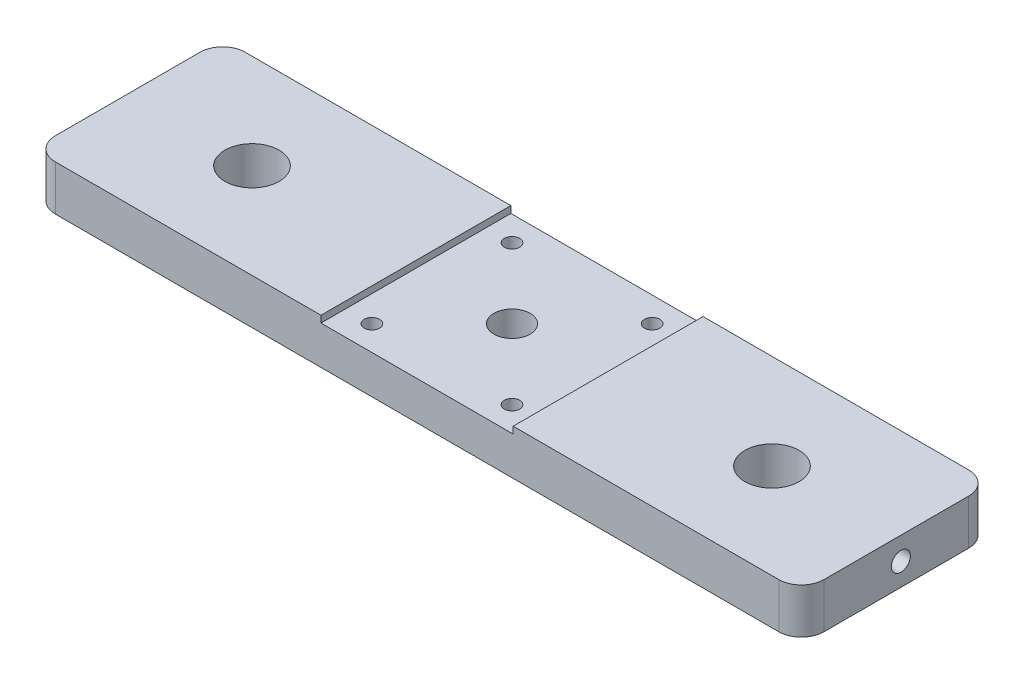
from build123d import *

# Parameters (mm, degrees)
ESBO_O1_W                                           = 170
ESBO_O1_H                                           = 42
ESBO_O1_R                                           = 6
ESBO_O1_R_2                                         = 4
RESSALTO_EXTRUS_O1_DEPTH                            = 10
REBAIXO_PARA_PARAFUSO_COM_CABE_A_PANELA_D           = 3.4
REBAIXO_PARA_PARAFUSO_COM_CABE_A_PANELA_CBORE_D     = 7
REBAIXO_PARA_PARAFUSO_COM_CABE_A_PANELA_CBORE_DEPTH = 2.4
ESBO_O7_W                                           = 42.5
ESBO_O7_H                                           = 46.397828282
CORTE_EXTRUS_O2_DEPTH                               = 1.5
FILETE1_R                                           = 5


with BuildPart() as part:
    # Esboço1 → Ressalto-extrusão1 (new body)
    with BuildSketch(Plane(origin=(0, 0, 0), x_dir=(1, 0, 0), z_dir=(0, 1, 0))):
        Rectangle(ESBO_O1_W, ESBO_O1_H)
        with Locations(Location((-57.5, 0, 0), (0, 0, 270))):
            Circle(ESBO_O1_R, mode=Mode.SUBTRACT)
        with Locations(Location((57.5, 0, 0), (0, 0, 270))):
            Circle(ESBO_O1_R, mode=Mode.SUBTRACT)
        with Locations(Location((0, 0, 0), (0, 0, 270))):
            Circle(ESBO_O1_R_2, mode=Mode.SUBTRACT)
    extrude(amount=RESSALTO_EXTRUS_O1_DEPTH)

    # Esboço2 → Furo roscado de M51 (revolve, cut)
    with BuildSketch(Plane(origin=(85, 5, -1), x_dir=(0, 0, -1), z_dir=(0, 1, 0))):
        Polygon((0, 0), (0, 15.2618073), (2.1, 14), (2.1, 0), align=None)
    furo_roscado_de_m51 = revolve(axis=Axis((91.35, 5, -1), (-1, 0, 0)), mode=Mode.SUBTRACT)

    # Espelhar1: Furo roscado de M51 across plane
    add(furo_roscado_de_m51.mirror(Plane(origin=(0, 0, 0), x_dir=(0, 0, 1), z_dir=(1, 0, 0))), mode=Mode.SUBTRACT)

    # Rebaixo para parafuso com cabeça panela de M31 (through all)
    with Locations(Plane(origin=(0, 0, 0), x_dir=(-1, 0, 0), z_dir=(0, -1, 0))):
        with Locations((-15.5, 15.5), (15.5, 15.5), (-15.5, -15.5), (15.5, -15.5)):
            CounterBoreHole(REBAIXO_PARA_PARAFUSO_COM_CABE_A_PANELA_D / 2, REBAIXO_PARA_PARAFUSO_COM_CABE_A_PANELA_CBORE_D / 2, REBAIXO_PARA_PARAFUSO_COM_CABE_A_PANELA_CBORE_DEPTH)

    # Esboço7 → Corte-extrusão2 (cut)
    with BuildSketch(Plane(origin=(0, 10, 0), x_dir=(1, 0, 0), z_dir=(0, 1, 0))):
        with Locations((0, -0.001085859)):
            Rectangle(ESBO_O7_W, ESBO_O7_H)
    extrude(amount=-CORTE_EXTRUS_O2_DEPTH, mode=Mode.SUBTRACT)

    # Filete1
    filete1_edges = [part.edges().sort_by_distance(p)[0] for p in [
        (85, 5, 21),
        (-85, 5, 21),
        (-85, 5, -21),
        (85, 5, -21),
    ]]
    fillet(filete1_edges, radius=FILETE1_R)


solid = part.part
